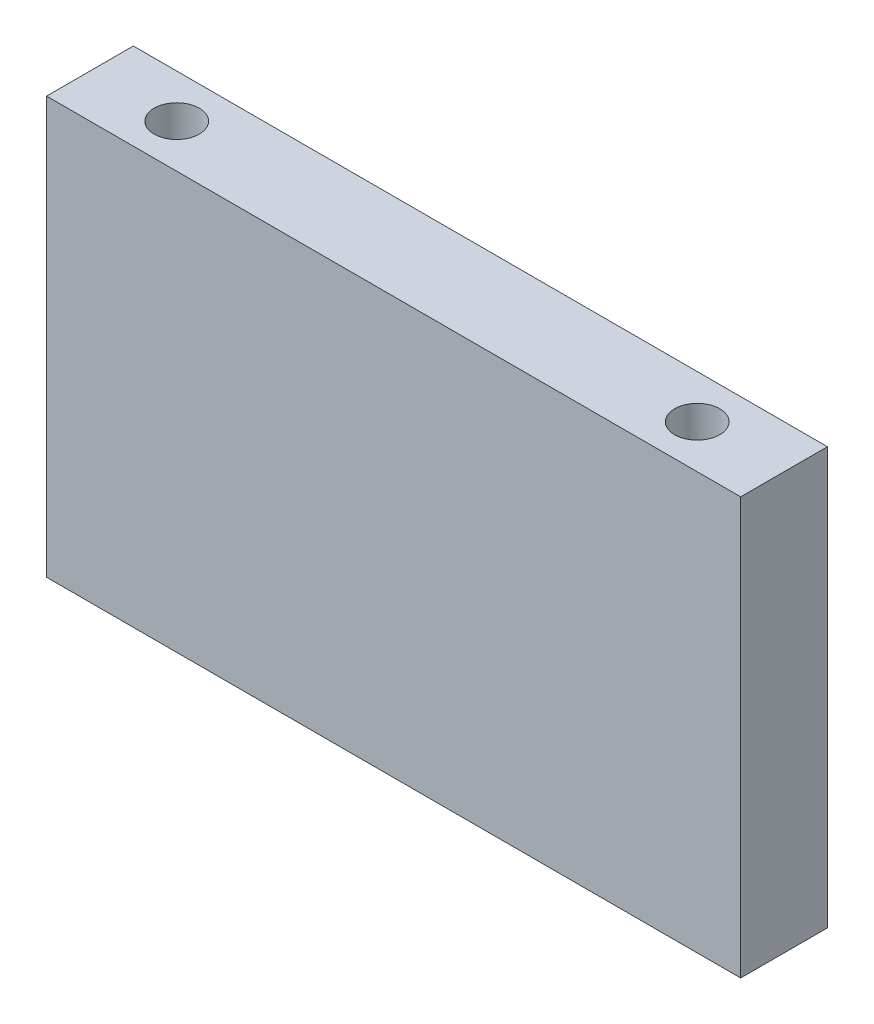
from build123d import *

# Parameters (mm, degrees)
SKETCH1_W             = 50.8
SKETCH1_H             = 30.5
BOSS_EXTRUDE1_DEPTH   = 6.35
M4X0_7_TAPPED_HOLE1_D = 3.3


with BuildPart() as part:
    # Sketch1 → Boss-Extrude1 (new body)
    with BuildSketch(Plane.XY):
        with Locations((25.4, 15.25)):
            Rectangle(SKETCH1_W, SKETCH1_H)
    extrude(amount=BOSS_EXTRUDE1_DEPTH)

    # M4x0.7 Tapped Hole1 (through all)
    with Locations(Plane(origin=(0, 30.5, 0), x_dir=(1, 0, 0), z_dir=(0, 1, 0))):
        with Locations((6.35, -3.175), (44.449999381, -3.181866345)):
            Hole(M4X0_7_TAPPED_HOLE1_D / 2)


solid = part.part
